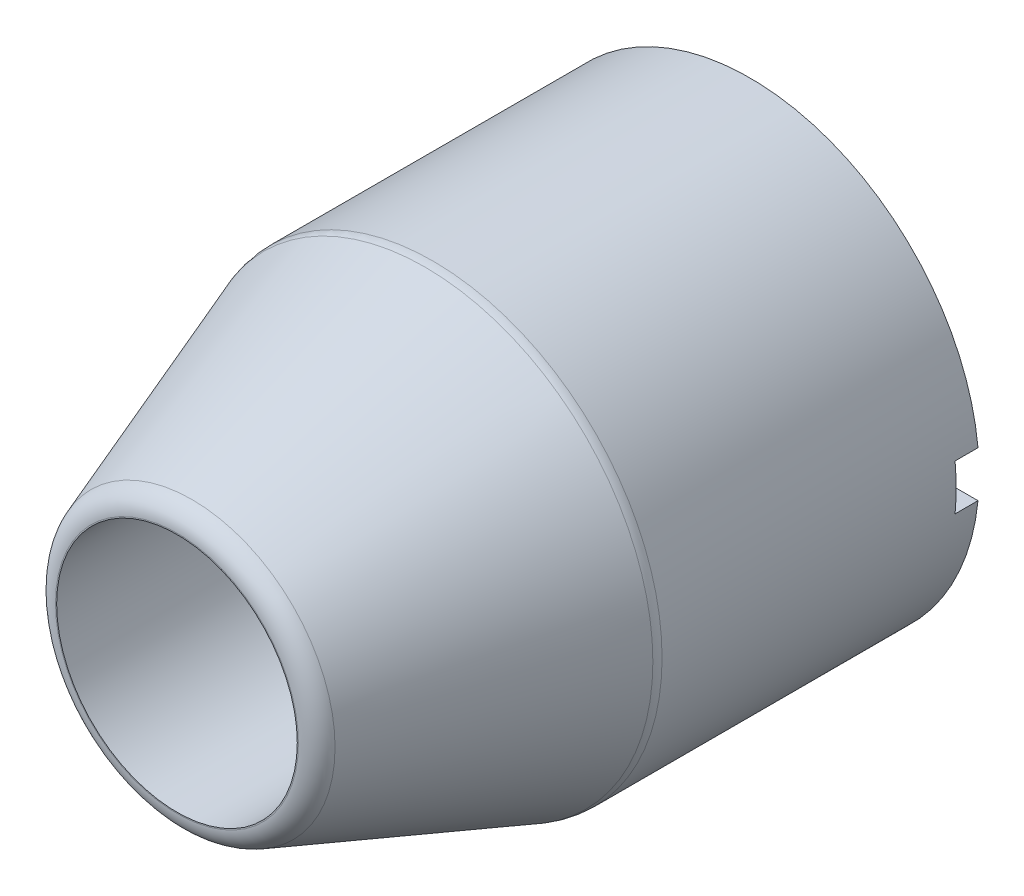
from build123d import *

# Parameters (mm, degrees)
SKETCH1_R           = 10
BOSS_EXTRUDE1_DEPTH = 25
SKETCH2_R           = 2
CUT_EXTRUDE1_DEPTH  = 29.722813233
SKETCH3_R           = 5.25
CUT_EXTRUDE2_DEPTH  = 8
CHAMFER1_SIZE       = 4
CHAMFER1_SIZE2      = 10.989909678
CHAMFER2_SIZE       = 2
FILLET1_R           = 1
SKETCH4_W           = 22.465701922
SKETCH4_H           = 2
CUT_EXTRUDE3_DEPTH  = 1


with BuildPart() as part:
    # Sketch1 → Boss-Extrude1 (new body)
    with BuildSketch(Plane.XY):
        Circle(SKETCH1_R)
    extrude(amount=BOSS_EXTRUDE1_DEPTH)

    # Sketch2 → Cut-Extrude1 (cut, through all)
    with BuildSketch(Plane.XY.offset(25)):
        Circle(SKETCH2_R)
    extrude(amount=-CUT_EXTRUDE1_DEPTH, mode=Mode.SUBTRACT)

    # Sketch3 → Cut-Extrude2 (cut)
    with BuildSketch(Plane.XY.offset(25)):
        Circle(SKETCH3_R)
    extrude(amount=-CUT_EXTRUDE2_DEPTH, mode=Mode.SUBTRACT)

    # Chamfer1
    chamfer1_edges = [part.edges().sort_by_distance(p)[0] for p in [
        (-10, 0, 25),
    ]]
    chamfer1_side = [part.faces().sort_by_distance(p)[0] for p in [
        (-9.717157288, 0, 25),
    ]]
    chamfer(chamfer1_edges, length=CHAMFER1_SIZE, length2=CHAMFER1_SIZE2, reference=chamfer1_side[0])

    # Chamfer2
    chamfer2_edges = [part.edges().sort_by_distance(p)[0] for p in [
        (-2, 0, 0),
    ]]
    chamfer(chamfer2_edges, length=CHAMFER2_SIZE)

    # Fillet1
    fillet1_edges = [part.edges().sort_by_distance(p)[0] for p in [
        (-6, 0, 25),
        (-10, 0, 14.010090322),
    ]]
    fillet(fillet1_edges, radius=FILLET1_R)

    # Sketch4 → Cut-Extrude3 (cut)
    with BuildSketch(Plane(origin=(0, 0, 0), x_dir=(-1, 0, 0), z_dir=(0, 0, -1))):
        Rectangle(SKETCH4_W, SKETCH4_H)
    extrude(amount=-CUT_EXTRUDE3_DEPTH, mode=Mode.SUBTRACT)


solid = part.part
